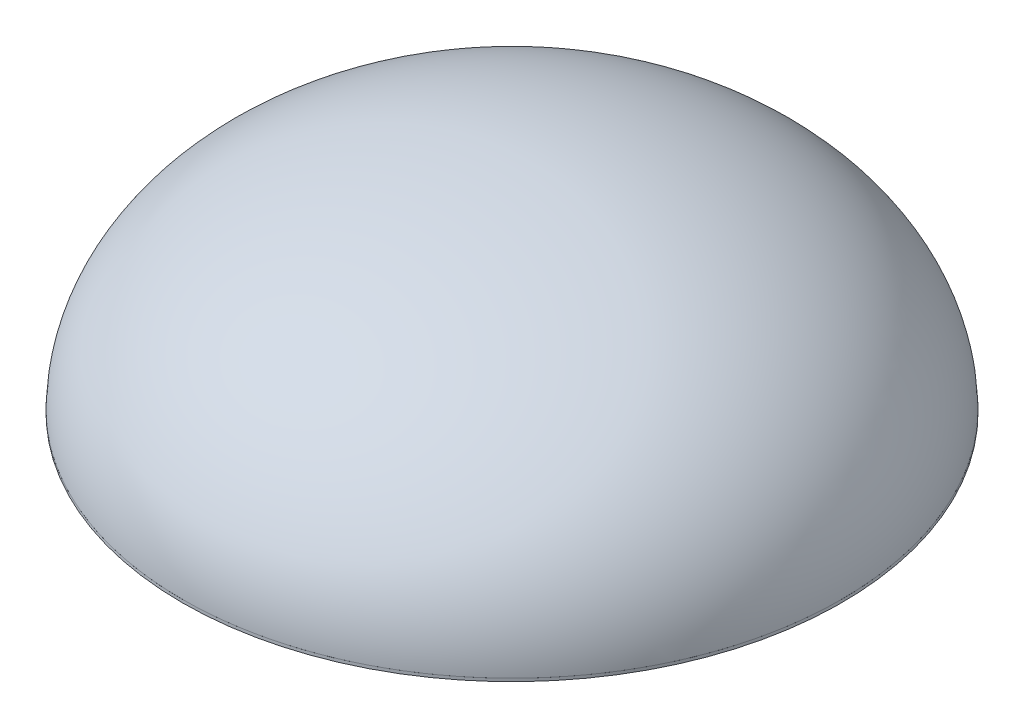
from build123d import *

# Parameters (mm, degrees)
SKETCH1_R           = 109.55
SKETCH1_R_2         = 101.35
EXTRUDE_THIN1_DEPTH = 1


with BuildPart() as part:
    # Sketch1 → Extrude-Thin1 (new body)
    with BuildSketch(Plane(origin=(0, 0, 0), x_dir=(1, 0, 0), z_dir=(0, 1, 0))):
        Circle(SKETCH1_R)
        Circle(SKETCH1_R_2, mode=Mode.SUBTRACT)
    extrude(amount=EXTRUDE_THIN1_DEPTH)

    # Sketch3 → Revolve1 (revolve)
    with BuildSketch(Plane(origin=(0, 0, 0), x_dir=(0, 0, -1), z_dir=(1, 0, 0)), mode=Mode.PRIVATE) as revolve1_sk:
        with BuildLine():
            add(Edge.make_bspline(
                [(101.35, 0), (101.35, 1.937500091), (101.060020098, 5.795589935), (99.312194, 13.516071204), (94.894470177, 23.092220218), (85.935283914, 34.093913916), (73.485985501, 44.033415682), (57.984989806, 52.361625208), (40.059980741, 58.631419517), (23.723457772, 61.87263911), (10.230762556, 63.180933549), (3.405425547, 63.4), (0, 63.4)],
                knots=[0, 0, 0, 0, 0.09817477, 0.196349541, 0.392699082, 0.589048623, 0.785398163, 0.981747704, 1.178097245, 1.374446786, 1.472621556, 1.570796327, 1.570796327, 1.570796327, 1.570796327], degree=3))
            Line((0, 63.4), (0, 71.6))
            add(Edge.make_bspline(
                [(109.55, 0), (109.55, 71.6), (0, 71.6)],
                knots=[0, 0, 0, 1.570796327, 1.570796327, 1.570796327], degree=2, weights=[1, 0.707106781, 1]))
            Line((109.55, 0), (101.35, 0))
        make_face()
    revolve(revolve1_sk.sketch.rotate(Axis((0, 0, 0), (0, 1, 0)), 180), axis=Axis((0, 0, 0), (0, 1, 0)))


solid = part.part
